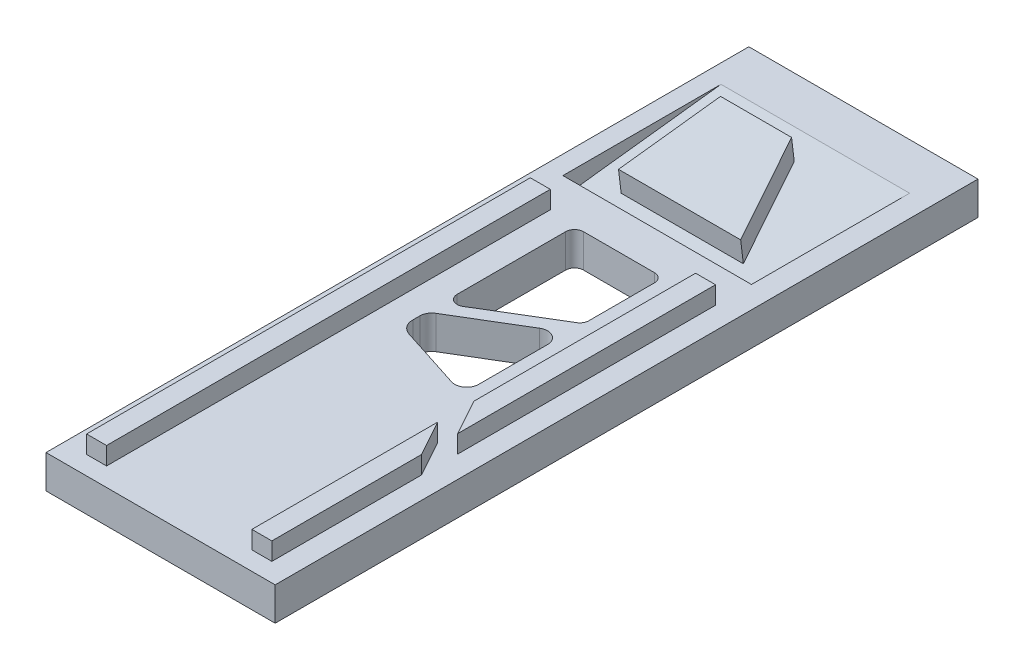
from build123d import *

# Parameters (mm, degrees)
SKETCH_1_W          = 10.65
SKETCH_1_H          = 32
EXTRUDE_1_DEPTH     = 1.5
CUT_EXTRUDE_START   = -1
CUT_EXTRUDE_1_DEPTH = 8.5
SKETCH_4_W          = 0.9
SKETCH_4_H          = 20
EXTRUDE_2_DEPTH     = 0.8
CUT_EXTRUDE_2_DEPTH = 5.8
CUT_EXTRUDE_3_DEPTH = 0.8
EXTRUDE_3_DEPTH     = 1
SKETCH_8_W          = 10.65
SKETCH_8_H          = 32
SKETCH_8_W_2        = 10.33
SKETCH_8_H_2        = 31.68
CUT_EXTRUDE_4_DEPTH = 10


with BuildPart() as part:
    # 草图1 → 凸台-拉伸1 (new body)
    with BuildSketch(Plane(origin=(0, 0, 0), x_dir=(1, 0, 0), z_dir=(0, 1, 0))):
        with Locations((5.325, -16)):
            Rectangle(SKETCH_1_W, SKETCH_1_H)
    extrude(amount=EXTRUDE_1_DEPTH)

    # 草图3 → 切除-拉伸1 (cut)
    with BuildSketch(Plane.ZY.offset(CUT_EXTRUDE_START)):
        Polygon((22.619658117, 1.5), (29.745922722, 1.5), (22.619658117, 0.65), align=None)
    extrude(amount=-CUT_EXTRUDE_1_DEPTH, mode=Mode.SUBTRACT)

    # 草图4 → 凸台-拉伸2 (add)
    with BuildSketch(Plane(origin=(0, 1.5, 0), x_dir=(1, 0, 0), z_dir=(0, 1, 0))):
        with Locations((1.6, -11)):
            Rectangle(SKETCH_4_W, SKETCH_4_H)
        with Locations((9.05, -11)):
            Rectangle(SKETCH_4_W, SKETCH_4_H)
    extrude(amount=EXTRUDE_2_DEPTH)

    # 草图5 → 切除-拉伸2 (cut)
    with BuildSketch(Plane(origin=(0, 1.5, 0), x_dir=(1, 0, 0), z_dir=(0, 1, 0))):
        with BuildLine():
            Line((3.25, -15.60411185), (3.25, -20.495209364))
            ThreePointArc((3.25, -20.495209364), (3.367157288, -20.778052076), (3.65, -20.895209364))
            Line((3.65, -20.895209364), (6.85, -20.895209364))
            ThreePointArc((6.85, -20.895209364), (7.132842712, -20.778052076), (7.25, -20.495209364))
            Line((7.25, -20.495209364), (7.25, -17.536917794))
            ThreePointArc((7.25, -17.536917794), (7.198369033, -17.340349696), (7.056804915, -17.194526604))
            Line((7.056804915, -17.194526604), (3.856804915, -15.261720659))
            ThreePointArc((3.856804915, -15.261720659), (3.453431902, -15.255742817), (3.25, -15.60411185))
        make_face()
        with BuildLine():
            Line((3.510326299, -14.380458294), (6.436346003, -16.139397213))
            ThreePointArc((6.436346003, -16.139397213), (6.977388991, -16.14656228), (7.25, -15.679162997))
            Line((7.25, -15.679162997), (7.25, -12.569402982))
            ThreePointArc((7.25, -12.569402982), (7.029399053, -12.135517868), (6.548846383, -12.05812148))
            Line((6.548846383, -12.05812148), (3.713121915, -12.968622573))
            ThreePointArc((3.713121915, -12.968622573), (3.378076137, -13.210716019), (3.25, -13.603731812))
            Line((3.25, -13.603731812), (3.25, -13.920224078))
            ThreePointArc((3.25, -13.920224078), (3.319590865, -14.184603216), (3.510326299, -14.380458294))
        make_face()
    extrude(amount=-CUT_EXTRUDE_2_DEPTH, mode=Mode.SUBTRACT)

    # 草图6 → 切除-拉伸3 (cut)
    with BuildSketch(Plane(origin=(0, 2.3, 0), x_dir=(1, 0, 0), z_dir=(0, 1, 0))):
        Polygon((9.5, -7.744189198), (8.6, -9.370124246), (8.6, -11), (9.5, -9.374064951), align=None)
    extrude(amount=-CUT_EXTRUDE_3_DEPTH, mode=Mode.SUBTRACT)

    # 草图7 → 凸台-拉伸3 (add)
    with BuildSketch(Plane(origin=(0, -2.01927835, 0.240853616), x_dir=(1, 0, 0), z_dir=(0, 0.9929615038625476, -0.11843754407715576))):
        Polygon((2.308389857, -23.863899052), (7.814564381, -23.863899052), (5.511982308, -28.494091265), (2.308389857, -28.494091265), align=None)
    extrude(amount=EXTRUDE_3_DEPTH)

    # 草图8 → 切除-拉伸4 (cut)
    with BuildSketch(Plane(origin=(0, 1.5, 0), x_dir=(1, 0, 0), z_dir=(0, 1, 0))):
        with Locations((5.325, -16)):
            Rectangle(SKETCH_8_W, SKETCH_8_H)
        with Locations((5.325, -16)):
            Rectangle(SKETCH_8_W_2, SKETCH_8_H_2, mode=Mode.SUBTRACT)
    extrude(amount=-CUT_EXTRUDE_4_DEPTH, mode=Mode.SUBTRACT)


with BuildPart() as body_2:
    # 镜向1: mirrored copy
    add(part.part.mirror(Plane.XY))


solid = body_2.part
